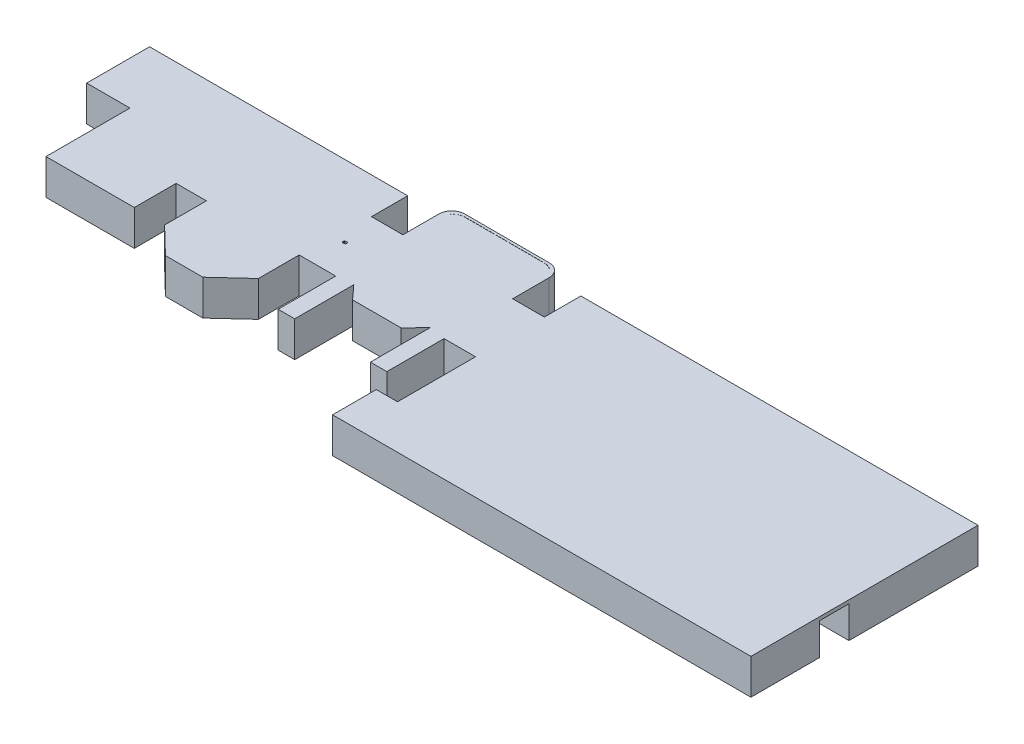
from build123d import *

# Parameters (mm, degrees)
BOSS_EXTRUDE1_DEPTH     = 4100
BOSS_EXTRUDE1_2_DEPTH   = 4100
BOSS_EXTRUDE1_3_DEPTH   = 4100
CUT_EXTRUDE2_DEPTH      = 200
CUT_EXTRUDE2_DEPTH_BACK = 1000
SKETCH8_W               = 4000
SKETCH8_H               = 1574.725224171
BOSS_EXTRUDE2_DEPTH     = 400
SKETCH10_W              = 4000
SKETCH10_H              = 1574.725224171
BOSS_EXTRUDE3_DEPTH     = 150


with BuildPart() as part:
    # Sketch5 → Boss-Extrude1 (new body)
    with BuildSketch(Plane(origin=(0, 0, 0), x_dir=(1, 0, 0), z_dir=(0, 1, 0))):
        Polygon((-62854.969491775, 3032.5434193), (-92722.442891537, 3032.5434193), (-92722.442891537, -4248.037983208), (-87714.630252684, -4248.037983208), (-87714.630252684, -13961.448907134), (-77497.684007523, -13961.448907134), (-77497.684007523, -9120.831801635), (-73993.999245447, -9120.831801635), (-73993.999245447, -13961.448907134), (-70874.353647814, -16978.243851345), (-66551.436516177, -16978.243851345), (-63204.037171957, -13893.822161368), (-63204.037171957, -9177.535874451), (-58974.210587207, -9177.535874451), (-58974.210587207, -15834.789027484), (-57060.499737676, -15834.789027484), (-57060.499737676, -8999.658062996), (-55614.702387222, -10587.318993272), (-49997.826624289, -10587.318993272), (-48338.773974021, -8876.998824422), (-48338.773974021, -15794.435779887), (-46437.441187314, -15794.435779887), (-46437.441187314, -9177.535874451), (-42795.906953804, -9177.535874451), (-42795.906953804, -18201.935134033), (-45253.433289974, -18201.935134033), (-45253.433289974, -23262.658838668), (3158.957531363, -23262.658838668), (3158.957531363, -15328.601141736), (-37892.428555691, -15328.601141736), (-37892.428555691, -18201.935134033), (-35343.296365796, -18201.935134033), (-35343.296365796, -20101.017145526), (-40314.073819657, -20101.017145526), (-40314.073819657, -14936.195598619), (-42544.305578732, -14936.195598619), (-42544.305578732, -13384.460420479), (-40314.073819657, -13384.460420479), (-40314.073819657, -8605.216818302), (-48338.773974021, -8619.236312499), (-50136.470996543, -10373.327428628), (-55355.779342749, -10373.327428628), (-57060.499737676, -8626.228460954), (-63481.182206834, -8626.228460954), (-63481.182206834, -13591.968549095), (-66551.436516177, -16662.222858439), (-70681.043303792, -16662.222858439), (-73704.520388125, -13701.734880029), (-73704.520388125, -5657.434184393), (-69334.040082689, -5657.434184393), (-69334.040082689, -2723.974810711), (-77712.653607025, -2723.974810711), (-77712.653607025, -3732.516174556), (-79338.691811209, -3732.516174556), (-79338.691811209, -2716.242296941), (-82681.103675364, -2716.242296941), (-82681.103675364, -10733.513998125), (-84329.725743495, -10733.513998125), (-84329.725743495, -8904.221018418), (-87423.715104233, -8904.221018418), (-87423.715104233, -1043.502104908), (-65946.021432816, -1043.502104908), (-65946.021432816, -2698.193280669), (-66861.72431649, -2698.193280669), (-66861.72431649, -5660.11065383), (-62893.678487237, -5660.11065383), (-62893.678487237, -1541.515953923), (-61139.275030104, -1541.515953923), (-61139.275030104, -1153.615193648), (-62854.969491775, -1153.615193648), align=None)
    extrude(amount=BOSS_EXTRUDE1_DEPTH)


with BuildPart() as body_2:
    # Sketch5 → Boss-Extrude1 2 (new body)
    with BuildSketch(Plane(origin=(0, 0, 0), x_dir=(1, 0, 0), z_dir=(0, 1, 0))):
        Polygon((-12313.028333178, -11916.639751867), (3158.957531363, -11916.639751867), (3158.957531363, 3013.360006537), (-42795.906953804, 3013.360006537), (-42795.906953804, -1217.323428695), (-44543.949233842, -1217.323428695), (-44543.949233842, -1414.449774136), (-42795.906953804, -1414.449774136), (-42795.906953804, -5614.479565918), (-15610.034301318, -5614.479565918), (-15610.034301318, -1822.890132319), (-2613.500033243, -1822.890132319), (-2613.500033243, 969.647657109), (-646.027271848, 969.647657109), (-646.027271848, -9455.936692923), (-2613.500033243, -9455.936692923), (-2613.500033243, -5114.719474681), (-12313.028333178, -5114.719474681), align=None)
    extrude(amount=BOSS_EXTRUDE1_2_DEPTH)


with BuildPart() as body_3:
    # Sketch5 → Boss-Extrude1 3 (new body)
    with BuildSketch(Plane(origin=(0, 0, 0), x_dir=(1, 0, 0), z_dir=(0, 1, 0))):
        with BuildLine():
            Line((-59226.532602146, -4121.47924984), (-55960.882280047, -4121.47924984))
            Line((-55960.882280047, -4121.47924984), (-55960.882280047, -5665.367364151))
            Line((-55960.882280047, -5665.367364151), (-49725.652353067, -5665.367364151))
            Line((-49725.652353067, -5665.367364151), (-49725.652353067, -4121.47924984))
            Line((-49725.652353067, -4121.47924984), (-46460.002030968, -4121.47924984))
            Line((-46460.002030968, -4121.47924984), (-46460.002030968, 3008.349613089))
            ThreePointArc((-46460.002030968, 3008.349613089), (-46899.341859188, 4069.009784869), (-47960.002030968, 4508.349613089))
            Line((-47960.002030968, 4508.349613089), (-57726.532602146, 4508.349613089))
            ThreePointArc((-57726.532602146, 4508.349613089), (-58787.192773926, 4069.009784869), (-59226.532602146, 3008.349613089))
            Line((-59226.532602146, 3008.349613089), (-59226.532602146, -4121.47924984))
        make_face()
        with BuildLine():
            Line((-57364.018387913, 4213.781855253), (-48224.726051815, 4213.781855253))
            ThreePointArc((-48224.726051815, 4213.781855253), (-47164.065880035, 3774.442027033), (-46724.726051815, 2713.781855253))
            Line((-46724.726051815, 2713.781855253), (-46724.726051815, -3848.072569742))
            Line((-46724.726051815, -3848.072569742), (-50057.992785226, -3848.072569742))
            Line((-50057.992785226, -3848.072569742), (-50057.992785226, -5398.429189933))
            Line((-50057.992785226, -5398.429189933), (-55530.751654502, -5398.429189933))
            Line((-55530.751654502, -5398.429189933), (-55530.751654502, -3848.072569742))
            Line((-55530.751654502, -3848.072569742), (-58864.018387913, -3848.072569742))
            Line((-58864.018387913, -3848.072569742), (-58864.018387913, 2713.781855253))
            ThreePointArc((-58864.018387913, 2713.781855253), (-58424.678559693, 3774.442027033), (-57364.018387913, 4213.781855253))
        make_face(mode=Mode.SUBTRACT)
    extrude(amount=BOSS_EXTRUDE1_3_DEPTH)


with BuildPart() as cut_extrude2_tool:
    # Sketch8 → Cut-Extrude2 (new, two sides: drawn at the far end of the back side and taken through both)
    with BuildSketch(Plane(origin=(0, 0, -3022.951712918), x_dir=(-1, 0, 0), z_dir=(0, 0, -1)).offset(-CUT_EXTRUDE2_DEPTH_BACK)):
        with Locations((5231.252465647, 2315.293735901)):
            Rectangle(SKETCH8_W, SKETCH8_H)
        with Locations((-28.405935853, 2315.293735901)):
            Rectangle(SKETCH8_W, SKETCH8_H)
        with Locations((15815.636386773, 2315.293735901)):
            Rectangle(SKETCH8_W, SKETCH8_H)
        with Locations((10555.977985272, 2315.293735901)):
            Rectangle(SKETCH8_W, SKETCH8_H)
        with Locations((23763.886231613, 2315.293735901)):
            Rectangle(SKETCH8_W, SKETCH8_H)
        with Locations((39607.928554239, 2315.293735901)):
            Rectangle(SKETCH8_W, SKETCH8_H)
        with Locations((29023.544633113, 2315.293735901)):
            Rectangle(SKETCH8_W, SKETCH8_H)
        with Locations((34348.270152738, 2315.293735901)):
            Rectangle(SKETCH8_W, SKETCH8_H)
        with Locations((72871.270372947, 2315.293735901)):
            Rectangle(SKETCH8_W, SKETCH8_H)
        with Locations((83455.654294073, 2315.293735901)):
            Rectangle(SKETCH8_W, SKETCH8_H)
        with Locations((88715.312695573, 2315.293735901)):
            Rectangle(SKETCH8_W, SKETCH8_H)
        with Locations((78130.928774448, 2315.293735901)):
            Rectangle(SKETCH8_W, SKETCH8_H)
        with Locations((67598.858524863, 2315.293735901)):
            Rectangle(SKETCH8_W, SKETCH8_H)
    extrude(amount=CUT_EXTRUDE2_DEPTH + CUT_EXTRUDE2_DEPTH_BACK)


with BuildPart() as part_1:
    add(part.part)

    # Cut-Extrude2: cut by cut_extrude2_tool
    add(cut_extrude2_tool.part, mode=Mode.SUBTRACT)



with BuildPart() as body_2_1:
    add(body_2.part)

    # Cut-Extrude2: cut by cut_extrude2_tool
    add(cut_extrude2_tool.part, mode=Mode.SUBTRACT)


with BuildPart() as part_2:
    add(part_1.part)

    add(body_2_1.part)  # Boss-Extrude2 merges body 2

    add(body_3.part)  # Boss-Extrude2 merges body 3
    # Sketch11 → Boss-Extrude2 (add)
    # profile 1 of 2: a face of its own
    with BuildSketch(Plane(origin=(0, 4100, 0), x_dir=(1, 0, 0), z_dir=(0, 1, 0))):
        Polygon((-62854.969491775, 3032.5434193), (-92722.442891537, 3032.5434193), (-92722.442891537, -4248.037983208), (-87714.630252684, -4248.037983208), (-87714.630252684, -13961.448907134), (-77497.684007523, -13961.448907134), (-77497.684007523, -9120.831801635), (-73993.999245447, -9120.831801635), (-73993.999245447, -13961.448907134), (-70874.353647814, -16978.243851345), (-66551.436516177, -16978.243851345), (-63204.037171957, -13893.822161368), (-63204.037171957, -9177.535874451), (-58974.210587207, -9177.535874451), (-58974.210587207, -15834.789027484), (-57060.499737676, -15834.789027484), (-57060.499737676, -8999.658062996), (-55614.702387222, -10587.318993272), (-49997.826624289, -10587.318993272), (-48338.773974021, -8876.998824422), (-48338.773974021, -15794.435779887), (-46437.441187314, -15794.435779887), (-46437.441187314, -9177.535874451), (-42795.906953804, -9177.535874451), (-42795.906953804, -18201.935134033), (-45253.433289974, -18201.935134033), (-45253.433289974, -23262.658838668), (3158.957531363, -23262.658838668), (3158.957531363, 3013.360006537), (-42795.906953804, 3013.360006537), (-42795.906953804, -1217.323428695), (-46460.002030968, -1217.323428695), (-46460.002030968, -4121.47924984), (-49725.652353067, -4121.47924984), (-49725.652353067, -5665.367364151), (-55960.882280047, -5665.367364151), (-55960.882280047, -4121.47924984), (-59226.532602146, -4121.47924984), (-59226.532602146, -1153.615193648), (-62854.969491775, -1153.615193648), align=None)
        with BuildLine():
            Line((-62020.014054855, -5388.888998251), (-62020.014054855, -5163.687596874))
            ThreePointArc((-62020.014054855, -5163.687596874), (-62005.369393914, -5128.332257815), (-61970.014054855, -5113.687596874))
            Line((-61970.014054855, -5113.687596874), (-61662.078613853, -5113.687596874))
            ThreePointArc((-61662.078613853, -5113.687596874), (-61626.723274794, -5128.332257815), (-61612.078613853, -5163.687596874))
            Line((-61612.078613853, -5163.687596874), (-61612.078613853, -5388.888998251))
            Line((-61612.078613853, -5388.888998251), (-61719.175469751, -5388.888998251))
            Line((-61719.175469751, -5388.888998251), (-61719.175469751, -5437.542435503))
            Line((-61719.175469751, -5437.542435503), (-61911.509537571, -5437.542435503))
            Line((-61911.509537571, -5437.542435503), (-61911.509537571, -5388.888998251))
            Line((-61911.509537571, -5388.888998251), (-62020.014054855, -5388.888998251))
        make_face(mode=Mode.SUBTRACT)
    # profile 2 of 2: a face of its own
    with BuildSketch(Plane(origin=(0, 4100, 0), x_dir=(1, 0, 0), z_dir=(0, 1, 0))):
        with BuildLine():
            Line((-58864.018387913, -3848.072569742), (-55530.751654502, -3848.072569742))
            Line((-55530.751654502, -3848.072569742), (-55530.751654502, -5398.429189933))
            Line((-55530.751654502, -5398.429189933), (-50057.992785226, -5398.429189933))
            Line((-50057.992785226, -5398.429189933), (-50057.992785226, -3848.072569742))
            Line((-50057.992785226, -3848.072569742), (-46724.726051815, -3848.072569742))
            Line((-46724.726051815, -3848.072569742), (-46724.726051815, 2713.781855253))
            ThreePointArc((-46724.726051815, 2713.781855253), (-47158.078595776, 3759.987444173), (-48204.284184695, 4193.339988134))
            Line((-48204.284184695, 4193.339988134), (-57384.460255033, 4193.339988134))
            ThreePointArc((-57384.460255033, 4193.339988134), (-58430.665843952, 3759.987444173), (-58864.018387913, 2713.781855253))
            Line((-58864.018387913, 2713.781855253), (-58864.018387913, -3848.072569742))
        make_face()
    extrude(amount=-BOSS_EXTRUDE2_DEPTH)

    # Sketch10 → Boss-Extrude3 (add)
    with BuildSketch(Plane(origin=(0, 0, -3022.951712918), x_dir=(-1, 0, 0), z_dir=(0, 0, -1))):
        with Locations((5231.252465647, 2315.293735901)):
            Rectangle(SKETCH10_W, SKETCH10_H)
        with Locations((-28.405935853, 2315.293735901)):
            Rectangle(SKETCH10_W, SKETCH10_H)
        with Locations((15815.636386773, 2315.293735901)):
            Rectangle(SKETCH10_W, SKETCH10_H)
        with Locations((10555.977985272, 2315.293735901)):
            Rectangle(SKETCH10_W, SKETCH10_H)
        with Locations((23763.886231613, 2315.293735901)):
            Rectangle(SKETCH10_W, SKETCH10_H)
        with Locations((39607.928554239, 2315.293735901)):
            Rectangle(SKETCH10_W, SKETCH10_H)
        with Locations((29023.544633113, 2315.293735901)):
            Rectangle(SKETCH10_W, SKETCH10_H)
        with Locations((34348.270152738, 2315.293735901)):
            Rectangle(SKETCH10_W, SKETCH10_H)
        with Locations((72871.270372947, 2315.293735901)):
            Rectangle(SKETCH10_W, SKETCH10_H)
        with Locations((83455.654294073, 2315.293735901)):
            Rectangle(SKETCH10_W, SKETCH10_H)
        with Locations((88715.312695573, 2315.293735901)):
            Rectangle(SKETCH10_W, SKETCH10_H)
        with Locations((78130.928774448, 2315.293735901)):
            Rectangle(SKETCH10_W, SKETCH10_H)
        with Locations((67598.858524863, 2315.293735901)):
            Rectangle(SKETCH10_W, SKETCH10_H)
    extrude(amount=-BOSS_EXTRUDE3_DEPTH)


solid = part_2.part
